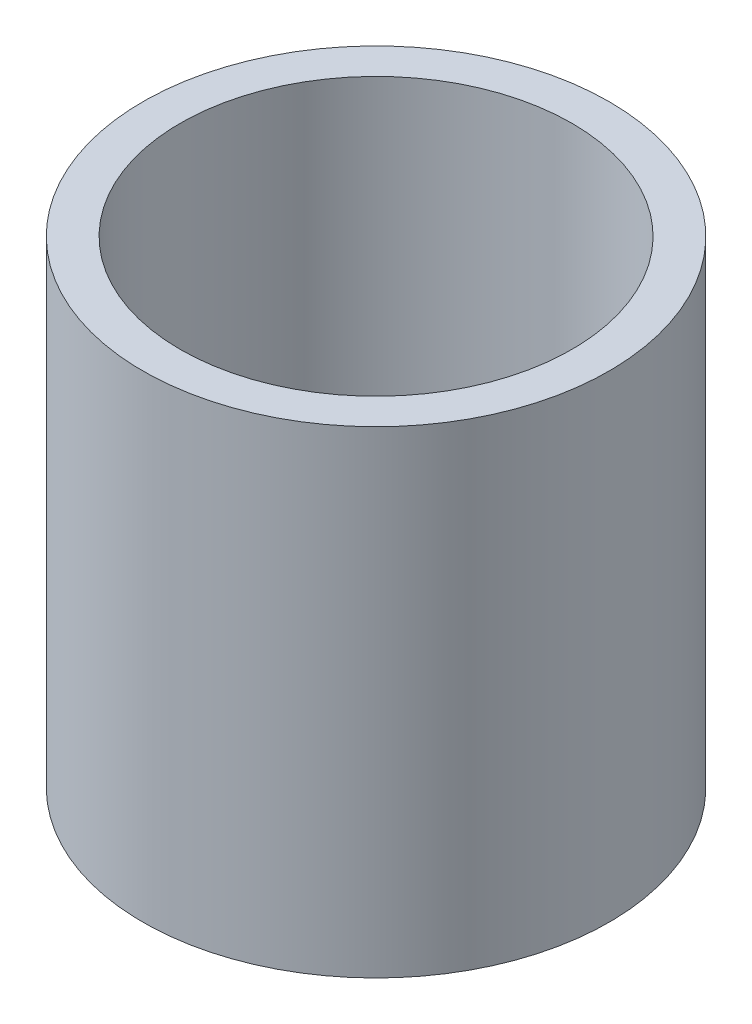
from build123d import *

# Parameters (mm, degrees)
SKETCH1_R           = 3.175
SKETCH1_R_2         = 2.667
BOSS_EXTRUDE1_DEPTH = 6.5


with BuildPart() as part:
    # Sketch1 → Boss-Extrude1 (new body)
    with BuildSketch(Plane(origin=(0, 0, 0), x_dir=(1, 0, 0), z_dir=(0, 1, 0))):
        with Locations(Location((0, 0, 0), (0, 0, 90))):
            Circle(SKETCH1_R)
        with Locations(Location((0, 0, 0), (0, 0, 90))):
            Circle(SKETCH1_R_2, mode=Mode.SUBTRACT)
    extrude(amount=BOSS_EXTRUDE1_DEPTH)


solid = part.part
